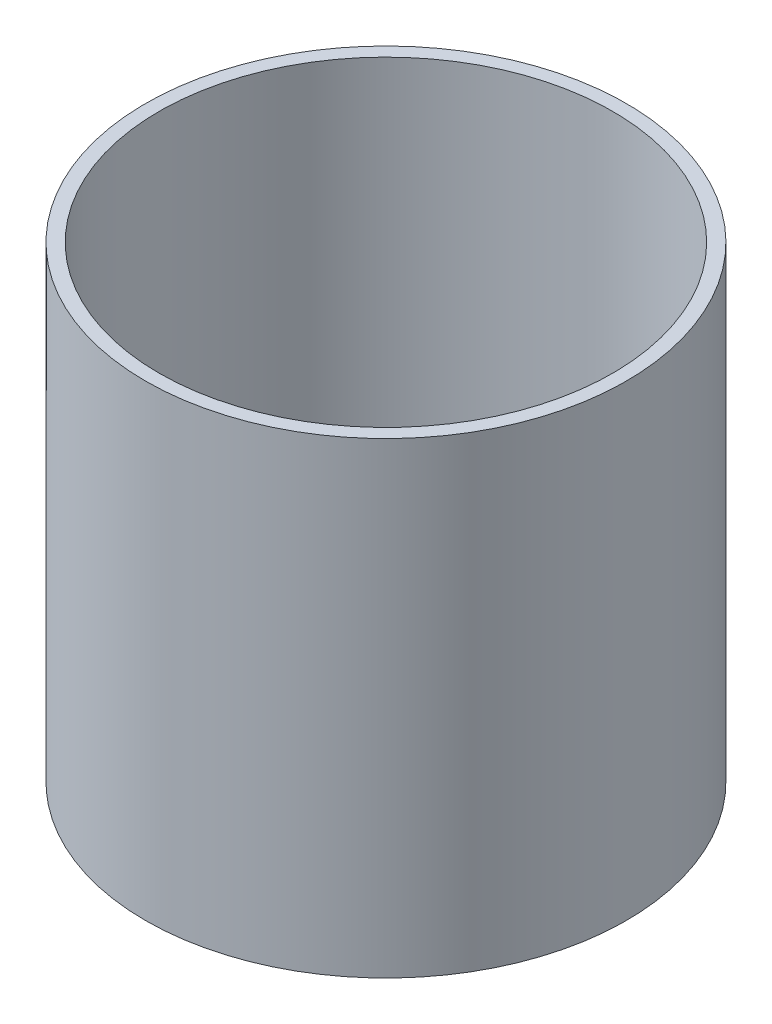
from build123d import *

# Parameters (mm, degrees)
SKETCH1_R           = 53
BOSS_EXTRUDE1_DEPTH = 103
SKETCH2_R           = 50
CUT_EXTRUDE1_DEPTH  = 100


with BuildPart() as part:
    # Sketch1 → Boss-Extrude1 (new body)
    with BuildSketch(Plane(origin=(0, 0, 0), x_dir=(1, 0, 0), z_dir=(0, 1, 0))):
        with Locations(Location((-21.650983604, 19.052865571, 0), (0, 0, 270))):
            Circle(SKETCH1_R)
    extrude(amount=BOSS_EXTRUDE1_DEPTH)

    # Sketch2 → Cut-Extrude1 (cut)
    with BuildSketch(Plane(origin=(0, 103, 0), x_dir=(1, 0, 0), z_dir=(0, 1, 0))):
        with Locations(Location((-21.650983604, 19.052865571, 0), (0, 0, 270))):
            Circle(SKETCH2_R)
    extrude(amount=-CUT_EXTRUDE1_DEPTH, mode=Mode.SUBTRACT)


solid = part.part
